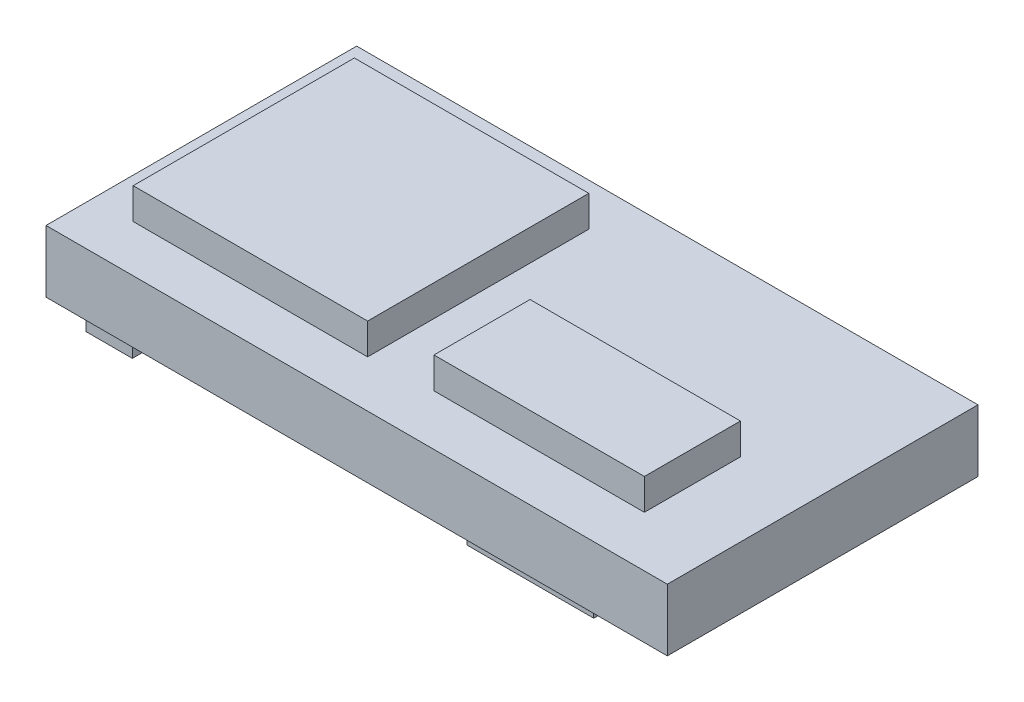
from build123d import *

# Parameters (mm, degrees)
SKETCH1_W           = 25.4
SKETCH1_H           = 12.7
BOSS_EXTRUDE1_DEPTH = 2.54
SKETCH2_W           = 9.583787324
SKETCH2_H           = 9.041308796
SKETCH2_W_2         = 8.602159512
SKETCH2_H_2         = 3.926511249
BOSS_EXTRUDE2_DEPTH = 1.27
SKETCH3_W           = 5.506895622
SKETCH3_H           = 5.893999151
SKETCH3_W_2         = 1.890426858
SKETCH3_H_2         = 2.97685463
SKETCH3_H_3         = 2.926527621
SKETCH3_H_4         = 2.612813109
SKETCH3_W_3         = 5.17306174
SKETCH3_H_5         = 3.865660491
BOSS_EXTRUDE3_DEPTH = 1.27


with BuildPart() as part:
    # Sketch1 → Boss-Extrude1 (new body)
    with BuildSketch(Plane(origin=(0, 0, 0), x_dir=(1, 0, 0), z_dir=(0, 1, 0))):
        Rectangle(SKETCH1_W, SKETCH1_H)
    extrude(amount=BOSS_EXTRUDE1_DEPTH)

    # Sketch2 → Boss-Extrude2 (add)
    with BuildSketch(Plane(origin=(0, 2.54, 0), x_dir=(1, 0, 0), z_dir=(0, 1, 0))):
        with Locations((-6.26433538, 0.090413088)):
            Rectangle(SKETCH2_W, SKETCH2_H)
        with Locations((5.386036811, -2.311991821)):
            Rectangle(SKETCH2_W_2, SKETCH2_H_2)
    extrude(amount=BOSS_EXTRUDE2_DEPTH)

    # Sketch3 → Boss-Extrude3 (add)
    with BuildSketch(Plane.XZ):
        with Locations((-1.163587027, 0.709784011)):
            Rectangle(SKETCH3_W, SKETCH3_H)
        with Locations((-10.984373833, -3.72564288)):
            Rectangle(SKETCH3_W_2, SKETCH3_H_2)
        with Locations((-10.984373833, 0.369096396)):
            Rectangle(SKETCH3_W_2, SKETCH3_H_3)
        with Locations((-10.984373833, 4.175284666)):
            Rectangle(SKETCH3_W_2, SKETCH3_H_4)
        with Locations((6.004852016, 3.317890469)):
            Rectangle(SKETCH3_W_3, SKETCH3_H_5)
    extrude(amount=BOSS_EXTRUDE3_DEPTH)


solid = part.part
